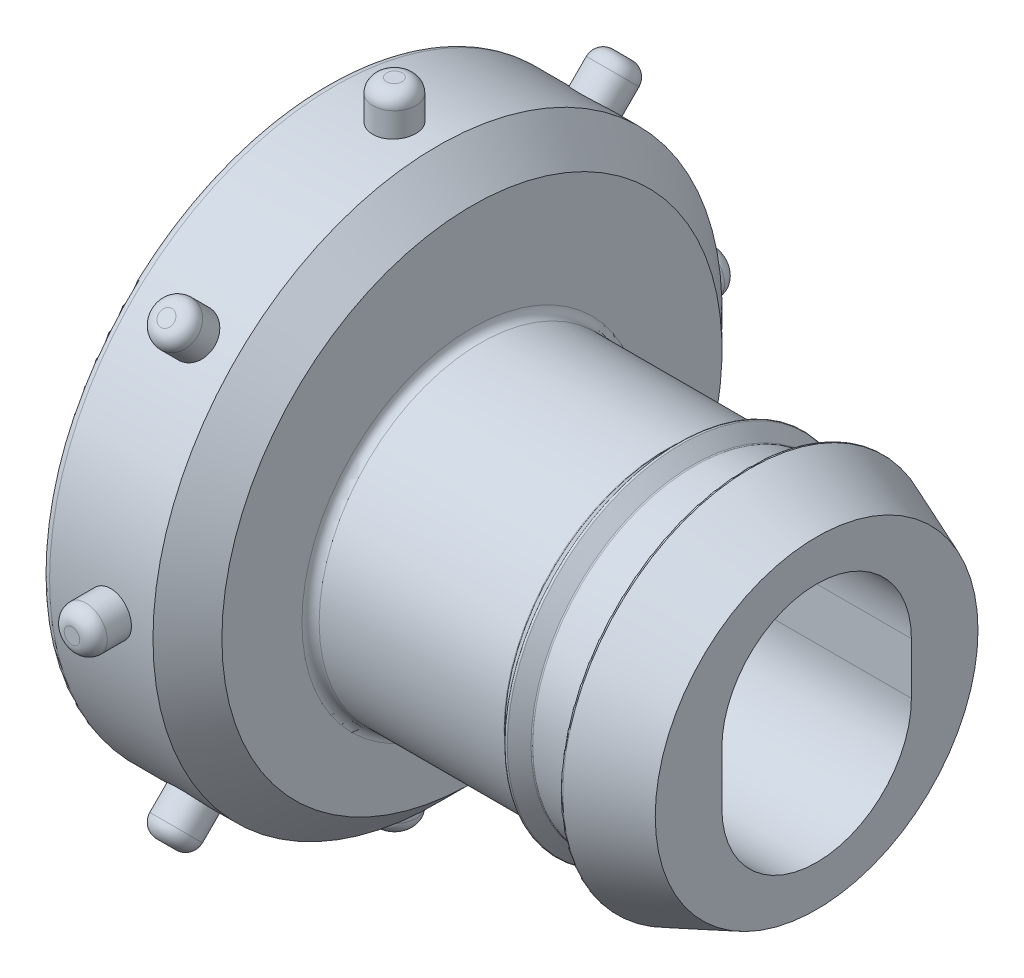
from build123d import *

# Parameters (mm, degrees)
SKETCH2_R                = 16.51
BOSS_EXTRUDE1_DEPTH      = 8.5
SKETCH4_W                = 18.18
SKETCH4_H                = 13.2
CUT_EXTRUDE1_DEPTH       = 7
SKETCH6_R                = 0.9
BOSS_EXTRUDE2_START      = -2
SKETCH7_R                = 1.25
BOSS_EXTRUDE2_DEPTH      = 4.2
FILLET2_R                = 0.8
CIRPATTERN1_COUNT        = 8
FILLET2_OF_CIRPATTERN1_R = 0.8
FILLET4_R                = 0.1
CUT_EXTRUDE2_DEPTH       = 35.036865308
CUT_EXTRUDE2_DEPTH_BACK  = 35.036865308
SKETCH8_W                = 3.59
SKETCH8_H                = 7.65
BOSS_EXTRUDE3_DEPTH      = 0.64
FILLET5_R                = 0.5
FILLET6_R                = 0.5
CHAMFER1_SIZE            = 2
FILLET7_R                = 1
CHAMFER2_SIZE            = 1
CHAMFER2_SIZE2           = 6
FILLET8_R                = 0.5


with BuildPart() as part:
    # Sketch1 → Revolve1 (revolve)
    with BuildSketch(Plane(origin=(0, 0, 0), x_dir=(1, 0, 0), z_dir=(0, 1, 0))):
        Polygon((0, 0), (-20, 0), (-20, 9.365), (-8.73, 9.365), (-7.94, 10.155), (-7.15, 9.365), (-3.97, 9.365), (-3.97, 10.955), (0, 9.365), align=None)
    revolve(axis=Axis((0, 0, 0), (-1, 0, 0)))

    # Sketch2 → Boss-Extrude1 (add)
    with BuildSketch(Plane.ZY.offset(20)):
        with Locations((0, 1.5)):
            Circle(SKETCH2_R)
        with BuildLine():
            ThreePointArc((-5.5, 1.5), (0, 7), (5.5, 1.5))
            Line((5.5, 1.5), (5.5, -1.5))
            ThreePointArc((5.5, -1.5), (0, -7), (-5.5, -1.5))
            Line((-5.5, -1.5), (-5.5, 1.5))
        make_face(mode=Mode.SUBTRACT)
    extrude(amount=BOSS_EXTRUDE1_DEPTH)

    # Sketch4 → Cut-Extrude1 (cut)
    with BuildSketch(Plane.ZY.offset(28.5)):
        with Locations((0, 1.029757623)):
            Rectangle(SKETCH4_W, SKETCH4_H)
    extrude(amount=-CUT_EXTRUDE1_DEPTH, mode=Mode.SUBTRACT)

    # Sketch6 → Cut-Revolve1 (revolve, cut)
    with BuildSketch(Plane.XY, mode=Mode.PRIVATE) as cut_revolve1_sk:
        with Locations((-28.5, 15.64)):
            Circle(SKETCH6_R)
    revolve(cut_revolve1_sk.sketch.rotate(Axis((-28.5, 1.5, 0), (1, 0, 0)), 90), axis=Axis((-28.5, 1.5, 0), (1, 0, 0)), mode=Mode.SUBTRACT)

    # Sketch7 → Boss-Extrude2 (add)
    with BuildSketch(Plane(origin=(0, 18.01, 0), x_dir=(1, 0, 0), z_dir=(0, 1, 0)).offset(BOSS_EXTRUDE2_START)):
        with Locations(Location((-24.5, 0, 0), (0, 0, 270))):
            Circle(SKETCH7_R)
    boss_extrude2 = extrude(amount=BOSS_EXTRUDE2_DEPTH)

    # Fillet2
    fillet2_edges = [part.edges().sort_by_distance(p)[0] for p in [
        (-24.5, 20.21, -1.25),
    ]]
    fillet(fillet2_edges, radius=FILLET2_R)

    # CirPattern1: Boss-Extrude2 ×8 about axis
    cirpattern1_axis = Axis((0, 1.5, 0), (1, 0, 0))
    for i in range(1, CIRPATTERN1_COUNT):
        add(boss_extrude2.rotate(cirpattern1_axis, i * 360 / CIRPATTERN1_COUNT))

    # Fillet2 of CirPattern1
    fillet2_of_cirpattern1_edges = [part.edges().sort_by_distance(p)[0] for p in [
        (-24.5, 15.613851352, 12.3460844),
        (-24.5, 2.75, 18.71),
        (-24.5, -10.8460844, 14.113851352),
        (-24.5, -17.21, 1.25),
        (-24.5, -12.613851352, -12.3460844),
        (-24.5, 0.25, -18.71),
        (-24.5, 13.8460844, -14.113851352),
    ]]
    fillet(fillet2_of_cirpattern1_edges, radius=FILLET2_OF_CIRPATTERN1_R)

    # Fillet4
    fillet4_edges = [part.edges().sort_by_distance(p)[0] for p in [
        (-3.97, 0, 9.365),
        (-3.97, 0, 10.955),
        (-8.73, 0, 9.365),
        (-7.94, 0, 10.155),
        (-7.15, 0, 9.365),
    ]]
    fillet(fillet4_edges, radius=FILLET4_R)

    # Sketch2<3> → Cut-Extrude2 (cut, two sides: drawn at the far end of the back side and taken through both)
    with BuildSketch(Plane.ZY.offset(20).offset(-CUT_EXTRUDE2_DEPTH_BACK)):
        with BuildLine():
            Line((5.5, 0), (5.5, 1.5))
            ThreePointArc((5.5, 1.5), (0, 7), (-5.5, 1.5))
            Line((-5.5, 1.5), (-5.5, 0))
            Line((-5.5, 0), (-5.5, -1.5))
            ThreePointArc((-5.5, -1.5), (0, -7), (5.5, -1.5))
            Line((5.5, -1.5), (5.5, 0))
        make_face()
    extrude(amount=CUT_EXTRUDE2_DEPTH + CUT_EXTRUDE2_DEPTH_BACK, mode=Mode.SUBTRACT)

    # Sketch8 → Boss-Extrude3 (add)
    with BuildSketch(Plane.ZY.offset(21.5)):
        with Locations((7.295, -1.745242377)):
            Rectangle(SKETCH8_W, SKETCH8_H)
    extrude(amount=BOSS_EXTRUDE3_DEPTH)

    # Fillet5
    fillet5_edges = [part.edges().sort_by_distance(p)[0] for p in [
        (-22.14, -1.745242377, 5.5),
        (-22.14, 2.079757623, 7.295),
    ]]
    fillet(fillet5_edges, radius=FILLET5_R)

    # Fillet6
    fillet6_edges = [part.edges().sort_by_distance(p)[0] for p in [
        (-20, 0, 9.365),
    ]]
    fillet(fillet6_edges, radius=FILLET6_R)

    # Chamfer1
    chamfer1_edges = [part.edges().sort_by_distance(p)[0] for p in [
        (-20, 1.5, -16.51),
    ]]
    chamfer(chamfer1_edges, length=CHAMFER1_SIZE)

    # Fillet7
    fillet7_edges = [part.edges().sort_by_distance(p)[0] for p in [
        (-28.5, 1.5, -13.24),
    ]]
    fillet(fillet7_edges, radius=FILLET7_R)

    # Chamfer2
    chamfer2_edges = [part.edges().sort_by_distance(p)[0] for p in [
        (-28.5, 7.629757623, 0),
    ]]
    chamfer2_side = [part.faces().sort_by_distance(p)[0] for p in [
        (-28.5, 1.5, -12.170205593),
    ]]
    chamfer(chamfer2_edges, length=CHAMFER2_SIZE, length2=CHAMFER2_SIZE2, reference=chamfer2_side[0])

    # Fillet8
    fillet8_edges = [part.edges().sort_by_distance(p)[0] for p in [
        (-28.5, 1.5, -16.51),
    ]]
    fillet(fillet8_edges, radius=FILLET8_R)


solid = part.part
